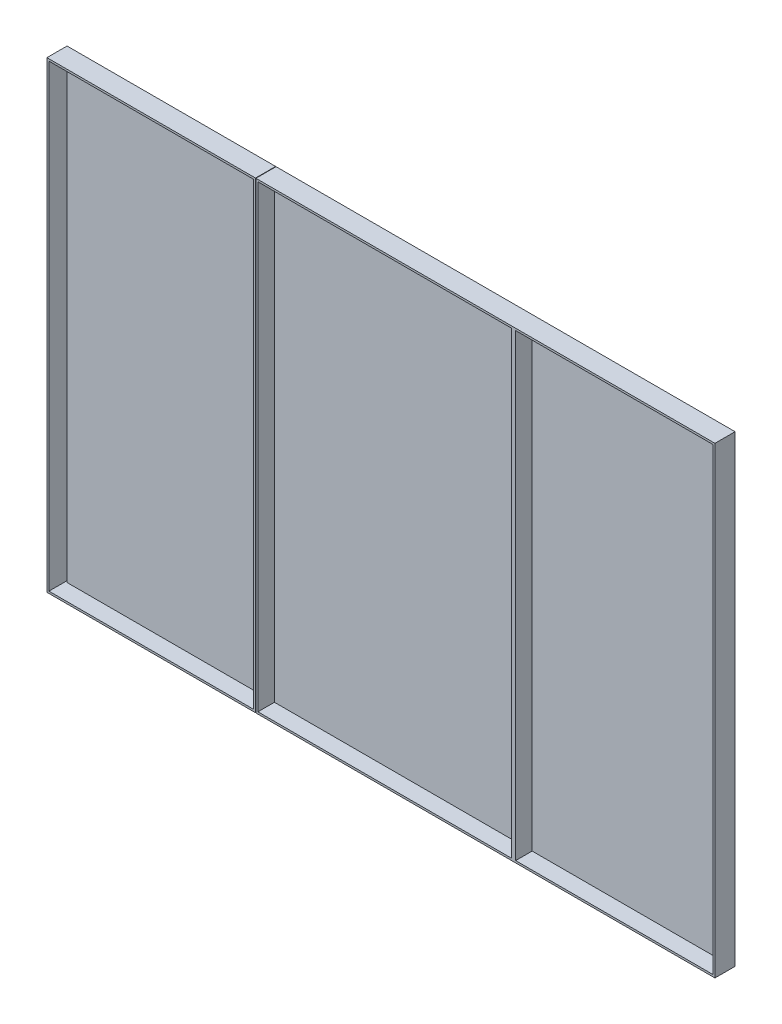
from build123d import *

# Parameters (mm, degrees)
ESQUISSE1_W         = 250
ESQUISSE1_H         = 570
BOSS_EXTRU_2_DEPTH  = 2
ESQUISSE11_W        = 259
ESQUISSE11_H        = 575
ESQUISSE11_W_2      = 254
ESQUISSE11_H_2      = 570
BOSS_EXTRU_12_DEPTH = 22.5
ESQUISSE12_W        = 259
ESQUISSE12_H        = 575
ESQUISSE12_W_2      = 209
ESQUISSE12_H_2      = 525
BOSS_EXTRU_13_DEPTH = 2.5
ESQUISSE13_W        = 320
ESQUISSE13_H        = 575
ESQUISSE13_W_2      = 315
ESQUISSE13_H_2      = 570
BOSS_EXTRU_14_DEPTH = 22.5
ESQUISSE14_W        = 320
ESQUISSE14_H        = 575
ESQUISSE14_W_2      = 270
ESQUISSE14_H_2      = 525
BOSS_EXTRU_15_DEPTH = 2.5
ESQUISSE15_W        = 315
ESQUISSE15_H        = 570
BOSS_EXTRU_16_DEPTH = 2
ESQUISSE18_W        = 250
ESQUISSE18_H        = 575
ESQUISSE18_W_2      = 245
ESQUISSE18_H_2      = 570
BOSS_EXTRU_19_DEPTH = 22.5
ESQUISSE19_W        = 250
ESQUISSE19_H        = 575
ESQUISSE19_W_2      = 200
ESQUISSE19_H_2      = 525
BOSS_EXTRU_20_DEPTH = 2.5
ESQUISSE20_W        = 245
ESQUISSE20_H        = 570
BOSS_EXTRU_21_DEPTH = 2


with BuildPart() as part:
    # Esquisse1 → Boss.-Extru.2 (new body)
    with BuildSketch(Plane.XY):
        with Locations((125, 285)):
            Rectangle(ESQUISSE1_W, ESQUISSE1_H)
    extrude(amount=BOSS_EXTRU_2_DEPTH)



with BuildPart() as body_2:
    # Esquisse11 → Boss.-Extru.12 (new body)
    with BuildSketch(Plane(origin=(0, 0, 0), x_dir=(-1, 0, 0), z_dir=(0, 0, -1))):
        with Locations((-125, 285)):
            Rectangle(ESQUISSE11_W, ESQUISSE11_H)
        with Locations((-125, 285)):
            Rectangle(ESQUISSE11_W_2, ESQUISSE11_H_2, mode=Mode.SUBTRACT)
    extrude(amount=-BOSS_EXTRU_12_DEPTH)


with BuildPart() as part_1:
    add(part.part)

    add(body_2.part)  # Boss.-Extru.13 merges body 2
    # Esquisse12 → Boss.-Extru.13 (add)
    with BuildSketch(Plane(origin=(0, 0, 0), x_dir=(-1, 0, 0), z_dir=(0, 0, -1))):
        with Locations((-125, 285)):
            Rectangle(ESQUISSE12_W, ESQUISSE12_H)
        with Locations((-125, 285)):
            Rectangle(ESQUISSE12_W_2, ESQUISSE12_H_2, mode=Mode.SUBTRACT)
    extrude(amount=BOSS_EXTRU_13_DEPTH)


with BuildPart() as body_2_2:
    # Esquisse13 → Boss.-Extru.14 (new body)
    with BuildSketch(Plane(origin=(0, 0, 0), x_dir=(-1, 0, 0), z_dir=(0, 0, -1))):
        with Locations((-415.009332024, 285)):
            Rectangle(ESQUISSE13_W, ESQUISSE13_H)
        with Locations((-415.009332024, 285)):
            Rectangle(ESQUISSE13_W_2, ESQUISSE13_H_2, mode=Mode.SUBTRACT)
    extrude(amount=-BOSS_EXTRU_14_DEPTH)

    # Esquisse14 → Boss.-Extru.15 (add)
    with BuildSketch(Plane(origin=(0, 0, 0), x_dir=(-1, 0, 0), z_dir=(0, 0, -1))):
        with Locations((-415.009332024, 285)):
            Rectangle(ESQUISSE14_W, ESQUISSE14_H)
        with Locations((-415.009332024, 285)):
            Rectangle(ESQUISSE14_W_2, ESQUISSE14_H_2, mode=Mode.SUBTRACT)
    extrude(amount=BOSS_EXTRU_15_DEPTH)

    # Esquisse18 → Boss.-Extru.19 (add)
    with BuildSketch(Plane(origin=(0, 0, 0), x_dir=(-1, 0, 0), z_dir=(0, 0, -1))):
        with Locations((-700.009332024, 285)):
            Rectangle(ESQUISSE18_W, ESQUISSE18_H)
        with Locations((-700.009332024, 285)):
            Rectangle(ESQUISSE18_W_2, ESQUISSE18_H_2, mode=Mode.SUBTRACT)
    extrude(amount=-BOSS_EXTRU_19_DEPTH)

    # Esquisse19 → Boss.-Extru.20 (add)
    with BuildSketch(Plane(origin=(0, 0, 0), x_dir=(-1, 0, 0), z_dir=(0, 0, -1))):
        with Locations((-700.009332024, 285)):
            Rectangle(ESQUISSE19_W, ESQUISSE19_H)
        with Locations((-700.009332024, 285)):
            Rectangle(ESQUISSE19_W_2, ESQUISSE19_H_2, mode=Mode.SUBTRACT)
    extrude(amount=BOSS_EXTRU_20_DEPTH)


with BuildPart() as body_3:
    # Esquisse15 → Boss.-Extru.16 (new body)
    with BuildSketch(Plane.XY):
        with Locations((415.009332024, 285)):
            Rectangle(ESQUISSE15_W, ESQUISSE15_H)
    extrude(amount=BOSS_EXTRU_16_DEPTH)


with BuildPart() as body_4:
    # Esquisse20 → Boss.-Extru.21 (new body)
    with BuildSketch(Plane.XY):
        with Locations((700.009332024, 285)):
            Rectangle(ESQUISSE20_W, ESQUISSE20_H)
    extrude(amount=BOSS_EXTRU_21_DEPTH)


solid = Compound([part_1.part, body_2_2.part, body_3.part, body_4.part])
